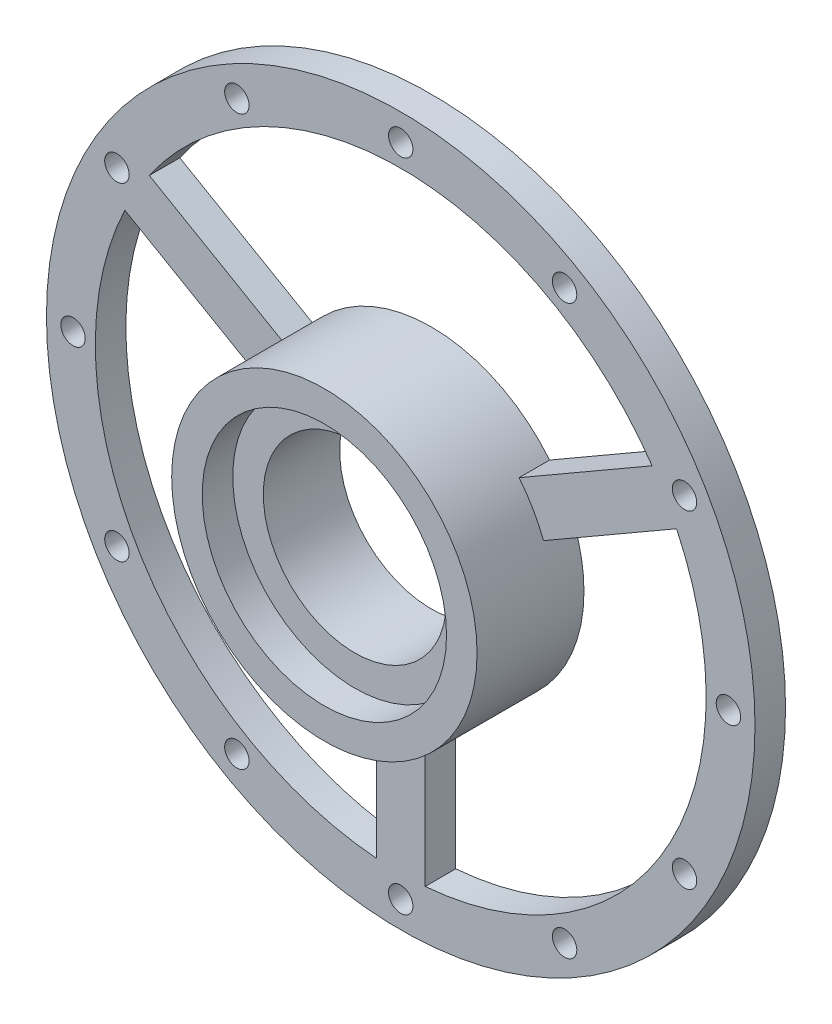
from build123d import *
from build123d.topology import SkipClean

# Parameters (mm, degrees)
CUT_EXTRUDE1_REACH = 167.943
SKETCH2_R          = 4
CUT_EXTRUDE2_REACH = 167.943


with BuildPart() as part:
    # Sketch1 → Revolve1 (revolve)
    with BuildSketch(Plane(origin=(0, 0, 0), x_dir=(0, 0, -1), z_dir=(1, 0, 0)), mode=Mode.PRIVATE) as revolve1_sk:
        Polygon((0, 30), (-25, 30), (-25, 40), (-35, 40), (-35, 50), (-10, 50), (-10, 116), (0, 116), align=None)
    revolve(revolve1_sk.sketch.rotate(Axis((0, 0, 100), (0, 0, -1)), 90), axis=Axis((0, 0, 100), (0, 0, -1)))

    # Sketch2 → Cut-Extrude1 (cut, up to next)
    with BuildSketch(Plane.XY.offset(10), mode=Mode.PRIVATE) as cut_extrude1_sk1:
        with Locations((0, -107.3)):
            Circle(SKETCH2_R)
    cut_extrude1_tool1 = extrude(cut_extrude1_sk1.sketch, amount=-CUT_EXTRUDE1_REACH, mode=Mode.PRIVATE) & part.part
    # Sketch2 → Cut-Extrude1 (cut, up to next)
    with BuildSketch(Plane.XY.offset(10), mode=Mode.PRIVATE) as cut_extrude1_sk2:
        with Locations((-53.65, -92.924525826)):
            Circle(SKETCH2_R)
    cut_extrude1_tool2 = extrude(cut_extrude1_sk2.sketch, amount=-CUT_EXTRUDE1_REACH, mode=Mode.PRIVATE) & part.part
    # Sketch2 → Cut-Extrude1 (cut, up to next)
    with BuildSketch(Plane.XY.offset(10), mode=Mode.PRIVATE) as cut_extrude1_sk3:
        with Locations((-92.924525826, -53.65)):
            Circle(SKETCH2_R)
    cut_extrude1_tool3 = extrude(cut_extrude1_sk3.sketch, amount=-CUT_EXTRUDE1_REACH, mode=Mode.PRIVATE) & part.part
    # Sketch2 → Cut-Extrude1 (cut, up to next)
    with BuildSketch(Plane.XY.offset(10), mode=Mode.PRIVATE) as cut_extrude1_sk4:
        with Locations((-107.3, 0)):
            Circle(SKETCH2_R)
    cut_extrude1_tool4 = extrude(cut_extrude1_sk4.sketch, amount=-CUT_EXTRUDE1_REACH, mode=Mode.PRIVATE) & part.part
    # Sketch2 → Cut-Extrude1 (cut, up to next)
    with BuildSketch(Plane.XY.offset(10), mode=Mode.PRIVATE) as cut_extrude1_sk5:
        with Locations((-92.924525826, 53.65)):
            Circle(SKETCH2_R)
    cut_extrude1_tool5 = extrude(cut_extrude1_sk5.sketch, amount=-CUT_EXTRUDE1_REACH, mode=Mode.PRIVATE) & part.part
    # Sketch2 → Cut-Extrude1 (cut, up to next)
    with BuildSketch(Plane.XY.offset(10), mode=Mode.PRIVATE) as cut_extrude1_sk6:
        with Locations((-53.65, 92.924525826)):
            Circle(SKETCH2_R)
    cut_extrude1_tool6 = extrude(cut_extrude1_sk6.sketch, amount=-CUT_EXTRUDE1_REACH, mode=Mode.PRIVATE) & part.part
    # Sketch2 → Cut-Extrude1 (cut, up to next)
    with BuildSketch(Plane.XY.offset(10), mode=Mode.PRIVATE) as cut_extrude1_sk7:
        with Locations((0, 107.3)):
            Circle(SKETCH2_R)
    cut_extrude1_tool7 = extrude(cut_extrude1_sk7.sketch, amount=-CUT_EXTRUDE1_REACH, mode=Mode.PRIVATE) & part.part
    # Sketch2 → Cut-Extrude1 (cut, up to next)
    with BuildSketch(Plane.XY.offset(10), mode=Mode.PRIVATE) as cut_extrude1_sk8:
        with Locations((53.65, 92.924525826)):
            Circle(SKETCH2_R)
    cut_extrude1_tool8 = extrude(cut_extrude1_sk8.sketch, amount=-CUT_EXTRUDE1_REACH, mode=Mode.PRIVATE) & part.part
    # Sketch2 → Cut-Extrude1 (cut, up to next)
    with BuildSketch(Plane.XY.offset(10), mode=Mode.PRIVATE) as cut_extrude1_sk9:
        with Locations((92.924525826, 53.65)):
            Circle(SKETCH2_R)
    cut_extrude1_tool9 = extrude(cut_extrude1_sk9.sketch, amount=-CUT_EXTRUDE1_REACH, mode=Mode.PRIVATE) & part.part
    # Sketch2 → Cut-Extrude1 (cut, up to next)
    with BuildSketch(Plane.XY.offset(10), mode=Mode.PRIVATE) as cut_extrude1_sk10:
        with Locations((107.3, 0)):
            Circle(SKETCH2_R)
    cut_extrude1_tool10 = extrude(cut_extrude1_sk10.sketch, amount=-CUT_EXTRUDE1_REACH, mode=Mode.PRIVATE) & part.part
    # Sketch2 → Cut-Extrude1 (cut, up to next)
    with BuildSketch(Plane.XY.offset(10), mode=Mode.PRIVATE) as cut_extrude1_sk11:
        with Locations((92.924525826, -53.65)):
            Circle(SKETCH2_R)
    cut_extrude1_tool11 = extrude(cut_extrude1_sk11.sketch, amount=-CUT_EXTRUDE1_REACH, mode=Mode.PRIVATE) & part.part
    # Sketch2 → Cut-Extrude1 (cut, up to next)
    with BuildSketch(Plane.XY.offset(10), mode=Mode.PRIVATE) as cut_extrude1_sk12:
        with Locations((53.65, -92.924525826)):
            Circle(SKETCH2_R)
    cut_extrude1_tool12 = extrude(cut_extrude1_sk12.sketch, amount=-CUT_EXTRUDE1_REACH, mode=Mode.PRIVATE) & part.part
    add(cut_extrude1_tool1.solids().sort_by_distance((0, -107.3, 10))[0], mode=Mode.SUBTRACT)
    add(cut_extrude1_tool2.solids().sort_by_distance((-53.65, -92.924526, 10))[0], mode=Mode.SUBTRACT)
    add(cut_extrude1_tool3.solids().sort_by_distance((-92.924526, -53.65, 10))[0], mode=Mode.SUBTRACT)
    add(cut_extrude1_tool4.solids().sort_by_distance((-107.3, 0, 10))[0], mode=Mode.SUBTRACT)
    add(cut_extrude1_tool5.solids().sort_by_distance((-92.924526, 53.65, 10))[0], mode=Mode.SUBTRACT)
    add(cut_extrude1_tool6.solids().sort_by_distance((-53.65, 92.924526, 10))[0], mode=Mode.SUBTRACT)
    add(cut_extrude1_tool7.solids().sort_by_distance((0, 107.3, 10))[0], mode=Mode.SUBTRACT)
    add(cut_extrude1_tool8.solids().sort_by_distance((53.65, 92.924526, 10))[0], mode=Mode.SUBTRACT)
    add(cut_extrude1_tool9.solids().sort_by_distance((92.924526, 53.65, 10))[0], mode=Mode.SUBTRACT)
    add(cut_extrude1_tool10.solids().sort_by_distance((107.3, 0, 10))[0], mode=Mode.SUBTRACT)
    add(cut_extrude1_tool11.solids().sort_by_distance((92.924526, -53.65, 10))[0], mode=Mode.SUBTRACT)
    add(cut_extrude1_tool12.solids().sort_by_distance((53.65, -92.924526, 10))[0], mode=Mode.SUBTRACT)

    # Sketch3 → Cut-Extrude2 (cut, up to next)
    with BuildSketch(Plane.XY.offset(10), mode=Mode.PRIVATE) as cut_extrude2_sk1:
        with BuildLine():
            ThreePointArc((82.32496742, 56.767946408), (0, 100), (-82.32496742, 56.767946408))
            Line((-82.32496742, 56.767946408), (-38.743420546, 31.606128589))
            ThreePointArc((-38.743420546, 31.606128589), (0, 50), (38.743420546, 31.606128589))
            Line((38.743420546, 31.606128589), (82.32496742, 56.767946408))
        make_face()
    cut_extrude2_tool1 = extrude(cut_extrude2_sk1.sketch, amount=-CUT_EXTRUDE2_REACH, mode=Mode.PRIVATE) & part.part
    # Sketch3 → Cut-Extrude2 (cut, up to next)
    with BuildSketch(Plane.XY.offset(10), mode=Mode.PRIVATE) as cut_extrude2_sk2:
        with BuildLine():
            Line((-46.743420546, 17.749722128), (-90.32496742, 42.911539947))
            ThreePointArc((-90.32496742, 42.911539947), (-86.602540378, -50), (-8, -99.679486355))
            Line((-8, -99.679486355), (-8, -49.355850717))
            ThreePointArc((-8, -49.355850717), (-43.301270189, -25), (-46.743420546, 17.749722128))
        make_face()
    cut_extrude2_tool2 = extrude(cut_extrude2_sk2.sketch, amount=-CUT_EXTRUDE2_REACH, mode=Mode.PRIVATE) & part.part
    # Sketch3 → Cut-Extrude2 (cut, up to next)
    with BuildSketch(Plane.XY.offset(10), mode=Mode.PRIVATE) as cut_extrude2_sk3:
        with BuildLine():
            ThreePointArc((100, 0), (97.551260222, 21.994354481), (90.32496742, 42.911539947))
            Line((90.32496742, 42.911539947), (46.743420546, 17.749722128))
            ThreePointArc((46.743420546, 17.749722128), (49.179116642, 9.022997636), (50, 0))
            ThreePointArc((50, 0), (38.078865529, -32.403703492), (8, -49.355850717))
            Line((8, -49.355850717), (8, -99.679486355))
            ThreePointArc((8, -99.679486355), (73.484692283, -67.823299831), (100, 0))
        make_face()
    cut_extrude2_tool3 = extrude(cut_extrude2_sk3.sketch, amount=-CUT_EXTRUDE2_REACH, mode=Mode.PRIVATE) & part.part
    add(cut_extrude2_tool1.solids().sort_by_distance((0, 66.985767, 10))[0], mode=Mode.SUBTRACT)
    add(cut_extrude2_tool2.solids().sort_by_distance((-58.011376, -33.492883, 10))[0], mode=Mode.SUBTRACT)
    add(cut_extrude2_tool3.solids().sort_by_distance((58.011376, -33.492883, 10))[0], mode=Mode.SUBTRACT)


solid = part.part
